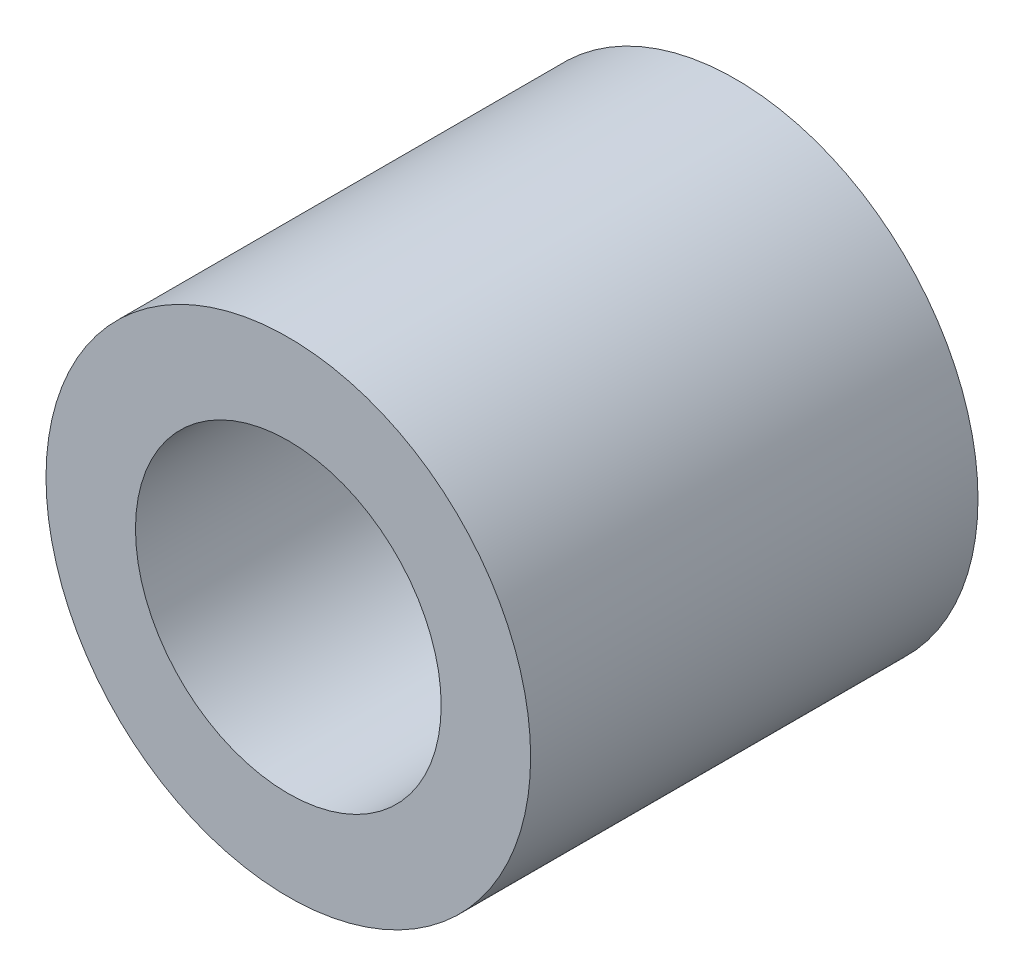
from build123d import *

# Parameters (mm, degrees)
SKETCH_1_R      = 1.625
SKETCH_1_R_2    = 1.025
EXTRUDE_1_DEPTH = 3


with BuildPart() as part:
    # 草图1 → 凸台-拉伸1 (new body)
    with BuildSketch(Plane.XY):
        Circle(SKETCH_1_R)
        Circle(SKETCH_1_R_2, mode=Mode.SUBTRACT)
    extrude(amount=EXTRUDE_1_DEPTH)


solid = part.part
